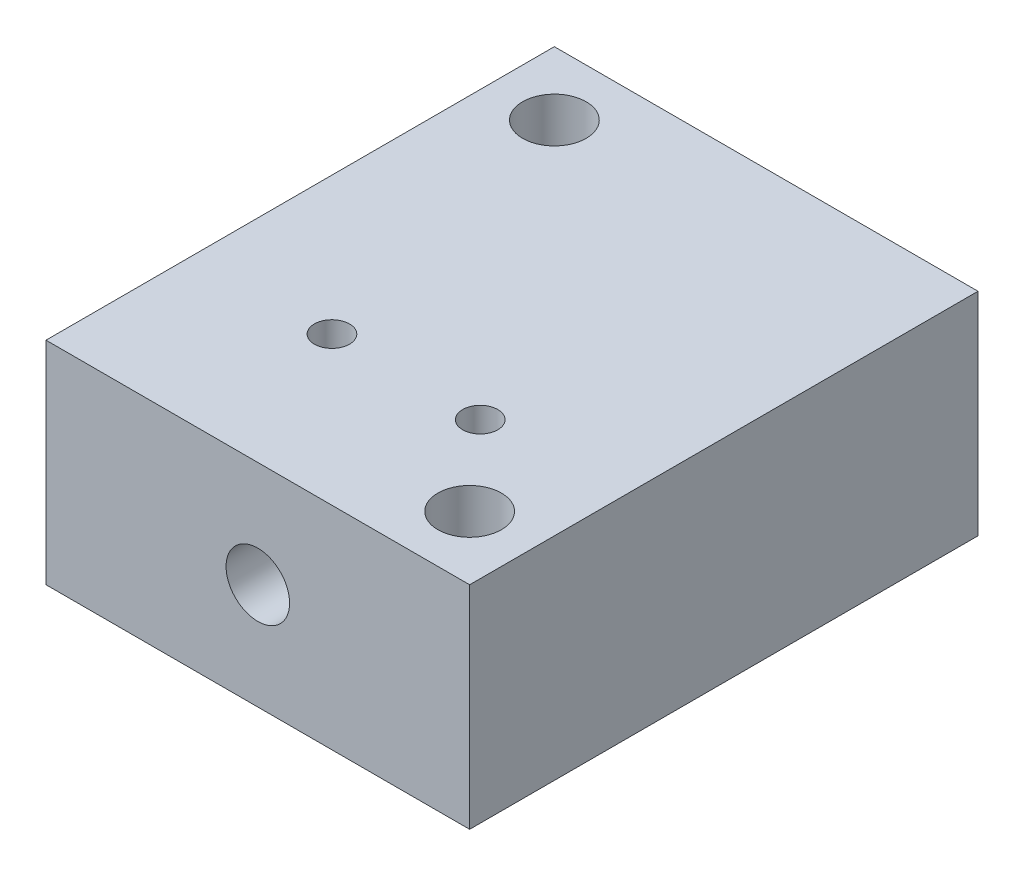
from build123d import *

# Parameters (mm, degrees)
SKIZZE1_W                                           = 100
SKIZZE1_H                                           = 50
AUFSATZ_LINEAR_AUSTRAGEN1_DEPTH                     = 120
STIRNSENKUNG_F_R_M8_SENKSCHRAUBE_KOPF_B_D           = 9
STIRNSENKUNG_F_R_M8_SENKSCHRAUBE_KOPF_B_CBORE_D     = 15
STIRNSENKUNG_F_R_M8_SENKSCHRAUBE_KOPF_B_CBORE_DEPTH = 45
STIRNSENKUNG_F_R_M8_SENKSCHRAUBE_KO_2_D             = 9
STIRNSENKUNG_F_R_M8_SENKSCHRAUBE_KO_2_CBORE_D       = 15
STIRNSENKUNG_F_R_M8_SENKSCHRAUBE_KO_2_CBORE_DEPTH   = 116
KERNLOCH_F_R_M8_HELICOIL1_D                         = 8.3
KERNLOCH_F_R_M8_HELICOIL1_DEPTH                     = 20
KERNLOCH_F_R_M8_HELICOIL1_TIP                       = 2.493571569


with BuildPart() as part:
    # Skizze1 → Aufsatz-Linear austragen1 (new body)
    with BuildSketch(Plane.XY):
        Rectangle(SKIZZE1_W, SKIZZE1_H)
    extrude(amount=AUFSATZ_LINEAR_AUSTRAGEN1_DEPTH)

    # Stirnsenkung f_r M8 Senkschraube _Kopf B (through all)
    with Locations(Plane(origin=(0, 25, 0), x_dir=(1, 0, 0), z_dir=(0, 1, 0))):
        with Locations((35, -105), (-35, -15)):
            CounterBoreHole(STIRNSENKUNG_F_R_M8_SENKSCHRAUBE_KOPF_B_D / 2, STIRNSENKUNG_F_R_M8_SENKSCHRAUBE_KOPF_B_CBORE_D / 2, STIRNSENKUNG_F_R_M8_SENKSCHRAUBE_KOPF_B_CBORE_DEPTH)

    # Stirnsenkung f_r M8 Senkschraube _Ko 2 (through all)
    with Locations(Plane.XY.offset(120)):
        with Locations((0, 0)):
            CounterBoreHole(STIRNSENKUNG_F_R_M8_SENKSCHRAUBE_KO_2_D / 2, STIRNSENKUNG_F_R_M8_SENKSCHRAUBE_KO_2_CBORE_D / 2, STIRNSENKUNG_F_R_M8_SENKSCHRAUBE_KO_2_CBORE_DEPTH)

    # Kernloch für M8 Helicoil1
    with Locations(Plane(origin=(0, 25, 0), x_dir=(1, 0, 0), z_dir=(0, 1, 0))):
        with Locations((-17.5, -85), (17.5, -85)):
            Hole(KERNLOCH_F_R_M8_HELICOIL1_D / 2, depth=KERNLOCH_F_R_M8_HELICOIL1_DEPTH)
            with Locations((0, 0, -(KERNLOCH_F_R_M8_HELICOIL1_DEPTH + KERNLOCH_F_R_M8_HELICOIL1_TIP / 2))):  # 118° drill point
                Cone(0, KERNLOCH_F_R_M8_HELICOIL1_D / 2, KERNLOCH_F_R_M8_HELICOIL1_TIP, mode=Mode.SUBTRACT)


solid = part.part
